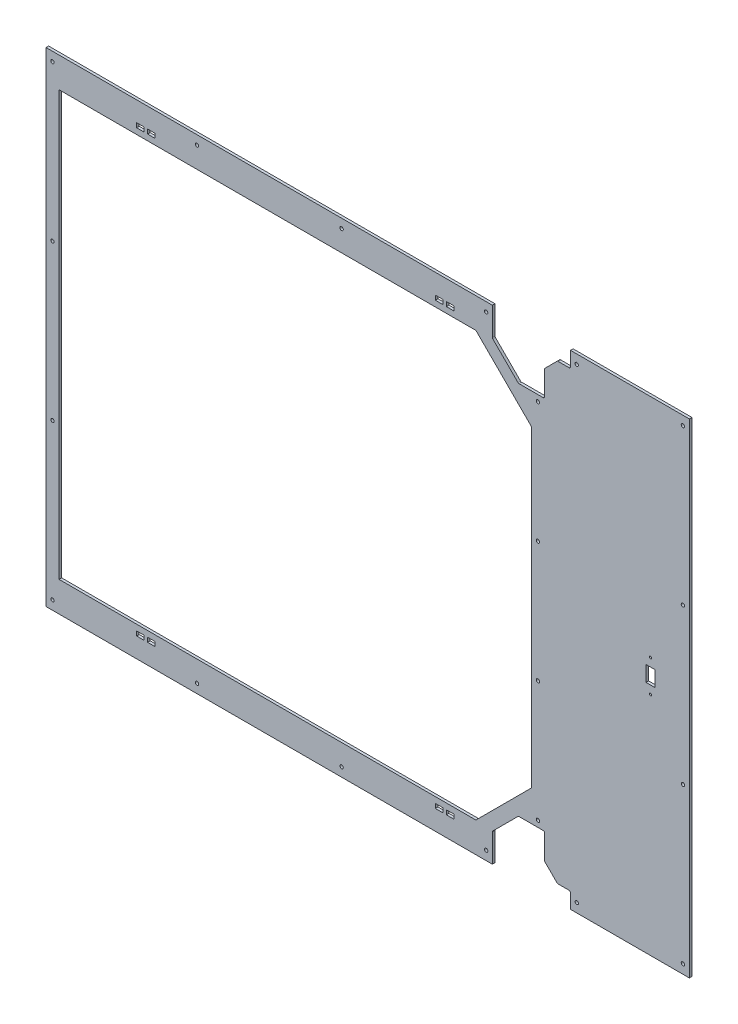
from build123d import *

# Parameters (mm, degrees)
SKETCH_1_W          = 994
SKETCH_1_H          = 748
EXTRUDE_1_DEPTH     = 4
CUT_EXTRUDE_6_DEPTH = 1063.039547286
SKETCH_2_W          = 11.5
SKETCH_2_H          = 6.8
CUT_EXTRUDE_1_DEPTH = 1063.039547286
SKETCH_3_R          = 2.6
CUT_EXTRUDE_4_DEPTH = 1063.039547286
SKETCH_6_R          = 1.75
SKETCH_6_W          = 14
SKETCH_6_H          = 24
CUT_EXTRUDE_7_DEPTH = 1063.039547286
FILLET_1_R          = 2.5


with BuildPart() as part:
    # Эскиз1 → Бобышка-Вытянуть1 (new body)
    with BuildSketch(Plane.XY):
        with Locations((497, 0)):
            Rectangle(SKETCH_1_W, SKETCH_1_H)
        Polygon((20, 327.55), (20, -327.55), (664.165728753, -327.55), (750, -241.715728753), (750, 241.715728753), (664.165728753, 327.55), align=None, mode=Mode.SUBTRACT)
    extrude(amount=EXTRUDE_1_DEPTH)

    # Эскиз5 → Вырез-Вытянуть6 (cut, through all)
    with BuildSketch(Plane.XY.offset(4)):
        Polygon((689.6, 329.834314575), (689.6, 374.4), (810.4, 374.4), (810.4, 349.6), (790.165685425, 349.6), (770.4, 329.834314575), (770.4, 289.6), (729.834314575, 289.6), align=None)
        Polygon((770.4, -329.834314575), (770.4, -289.6), (729.834314575, -289.6), (689.6, -329.834314575), (689.6, -374.4), (810.4, -374.4), (810.4, -349.6), (790.165685425, -349.6), align=None)
    extrude(amount=-CUT_EXTRUDE_6_DEPTH, mode=Mode.SUBTRACT)

    # Эскиз2 → Вырез-Вытянуть1 (cut, through all)
    with BuildSketch(Plane.XY.offset(4)):
        with Locations((607.25, 340.02)):
            Rectangle(SKETCH_2_W, SKETCH_2_H)
        with Locations((624.25, 340.02)):
            Rectangle(SKETCH_2_W, SKETCH_2_H)
        with Locations((624.25, -340.02)):
            Rectangle(SKETCH_2_W, SKETCH_2_H)
        with Locations((607.25, -340.02)):
            Rectangle(SKETCH_2_W, SKETCH_2_H)
        with Locations((145.75, 340.02)):
            Rectangle(SKETCH_2_W, SKETCH_2_H)
        with Locations((162.75, 340.02)):
            Rectangle(SKETCH_2_W, SKETCH_2_H)
        with Locations((145.75, -340.02)):
            Rectangle(SKETCH_2_W, SKETCH_2_H)
        with Locations((162.75, -340.02)):
            Rectangle(SKETCH_2_W, SKETCH_2_H)
    extrude(amount=-CUT_EXTRUDE_1_DEPTH, mode=Mode.SUBTRACT)

    # Эскиз3 → Вырез-Вытянуть4 (cut, through all)
    with BuildSketch(Plane.XY.offset(4)):
        with Locations((10, 360)):
            Circle(SKETCH_3_R)
        with Locations((10, 120)):
            Circle(SKETCH_3_R)
        with Locations((10, -120)):
            Circle(SKETCH_3_R)
        with Locations((10, -360)):
            Circle(SKETCH_3_R)
        with Locations((233.33, 360)):
            Circle(SKETCH_3_R)
        with Locations((456.66, 360)):
            Circle(SKETCH_3_R)
        with Locations((679.99, 360)):
            Circle(SKETCH_3_R)
        with Locations((233.33, -360)):
            Circle(SKETCH_3_R)
        with Locations((456.66, -360)):
            Circle(SKETCH_3_R)
        with Locations((679.99, -360)):
            Circle(SKETCH_3_R)
        with Locations((984, 360)):
            Circle(SKETCH_3_R)
        with Locations((984, 120)):
            Circle(SKETCH_3_R)
        with Locations((984, -120)):
            Circle(SKETCH_3_R)
        with Locations((984, -360)):
            Circle(SKETCH_3_R)
        with Locations((820, -360)):
            Circle(SKETCH_3_R)
        with Locations((820, 360)):
            Circle(SKETCH_3_R)
        with Locations((760, 280)):
            Circle(SKETCH_3_R)
        with Locations((760, 93.33)):
            Circle(SKETCH_3_R)
        with Locations((760, -93.34)):
            Circle(SKETCH_3_R)
        with Locations((760, -280.01)):
            Circle(SKETCH_3_R)
    extrude(amount=-CUT_EXTRUDE_4_DEPTH, mode=Mode.SUBTRACT)

    # Эскиз6 → Вырез-Вытянуть7 (cut, through all)
    with BuildSketch(Plane.XY.offset(4)):
        with Locations((934, 24.8)):
            Circle(SKETCH_6_R)
        with Locations((934, -24.8)):
            Circle(SKETCH_6_R)
        with Locations((934, 0)):
            Rectangle(SKETCH_6_W, SKETCH_6_H)
    extrude(amount=-CUT_EXTRUDE_7_DEPTH, mode=Mode.SUBTRACT)

    # Скругление1
    fillet_1_edges = [part.edges().sort_by_distance(p)[0] for p in [
        (689.6, 329.834314575, 2),
        (729.834314575, 289.6, 2),
        (810.4, 349.6, 2),
        (790.165685425, 349.6, 2),
        (770.4, 329.834314575, 2),
        (770.4, 289.6, 2),
        (810.4, -349.6, 2),
        (689.6, -329.834314575, 2),
        (729.834314575, -289.6, 2),
        (770.4, -289.6, 2),
        (770.4, -329.834314575, 2),
        (790.165685425, -349.6, 2),
    ]]
    fillet(fillet_1_edges, radius=FILLET_1_R)


solid = part.part
